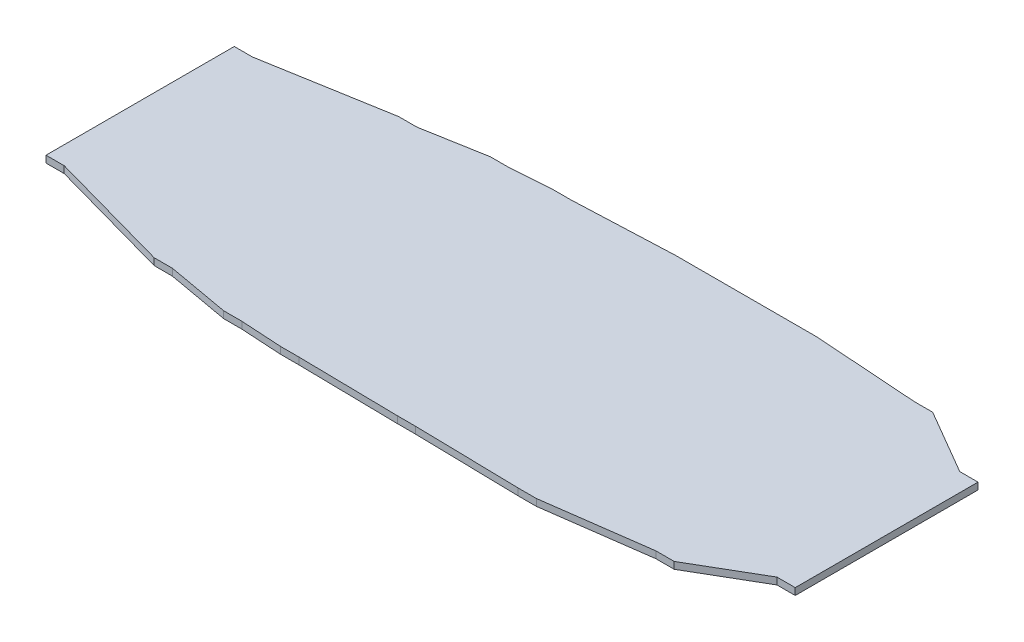
from build123d import *

# Parameters (mm, degrees)
EXTRUDE_1_DEPTH = 3


with BuildPart() as part:
    # 草图2 → 凸台-拉伸1 (new body)
    with BuildSketch(Plane(origin=(0, 0, 0), x_dir=(1, 0, 0), z_dir=(0, 1, 0))):
        Polygon((-164.250453447, 43.992099143), (-164.250453447, -38.575217414), (-156.250453447, -38.575217414), (-101.593567099, -53.798361105), (-93.593567099, -53.798361105), (-66.208524408, -58.698686744), (-58.208524408, -58.698686744), (-40.141191871, -59.767320554), (-32.141191871, -59.767320554), (11.732938579, -60.483417299), (19.732938579, -60.483417299), (65.634661476, -61.432753586), (73.634661476, -61.432753586), (119.770630773, -55.105959377), (127.770630773, -55.105959377), (156.250453447, -38.524764499), (164.250453447, -38.524764499), (164.250453447, 41.621622565), (156.250453447, 41.621622565), (127.770630773, 58.224282644), (119.770630773, 58.224282644), (73.634661476, 61.432753586), (65.634661476, 61.432753586), (19.732938579, 61.409444378), (11.732938579, 61.409444378), (-32.141191871, 59.544459715), (-40.141191871, 59.544459715), (-58.208524408, 58.252780522), (-66.208524408, 58.252780522), (-93.593567099, 53.410080957), (-101.593567099, 53.410080957), (-156.250453447, 43.992099143), align=None)
    extrude(amount=EXTRUDE_1_DEPTH)


solid = part.part
